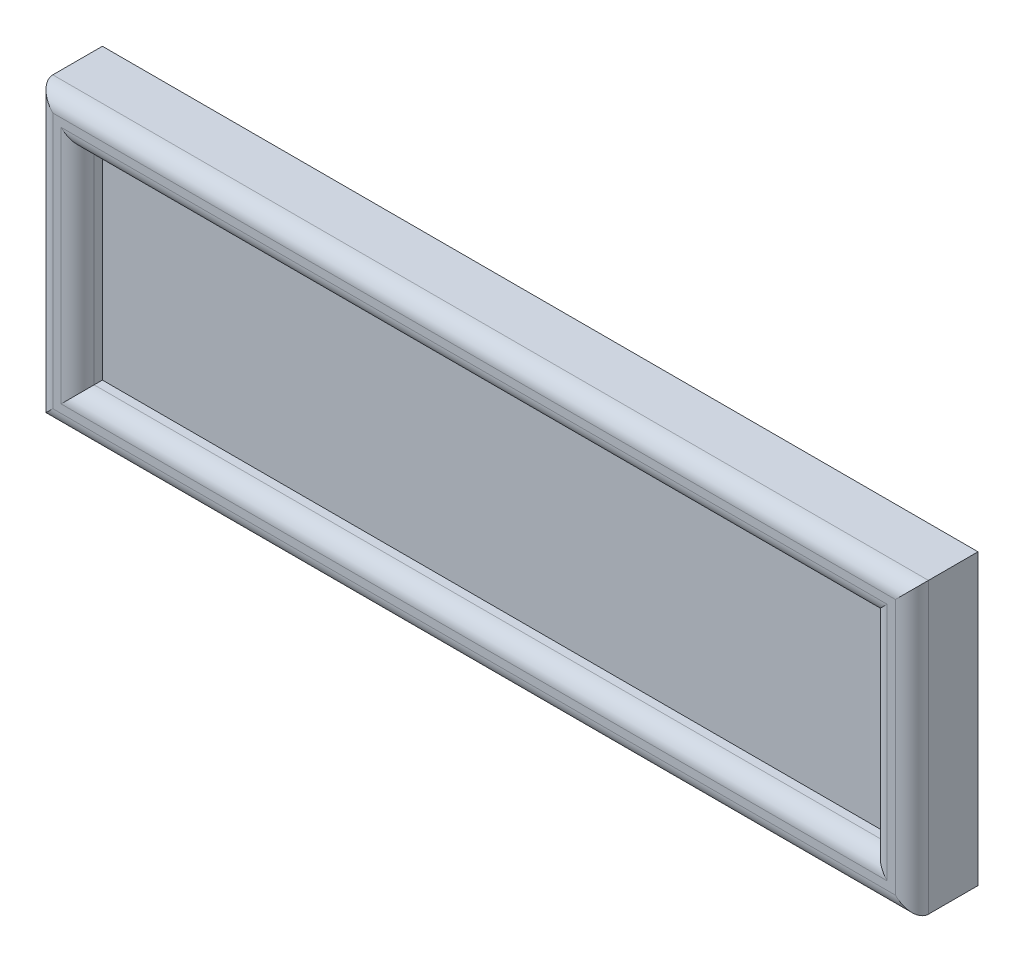
from build123d import *

# Parameters (mm, degrees)
SKETCH_1_W          = 53
SKETCH_1_H          = 17.5
EXTRUDE_1_DEPTH     = 2
SKETCH_3_W          = 51
SKETCH_3_H          = 15.5
CUT_EXTRUDE_2_DEPTH = 0.5
SKETCH_2_W          = 48
SKETCH_2_H          = 12.5
CUT_EXTRUDE_3_DEPTH = 2
FILLET_1_R          = 1
SKETCH_5_W          = 0.1
SKETCH_5_H          = 15.5
CUT_EXTRUDE_5_DEPTH = 28.978786607


with BuildPart() as part:
    # Эскиз1 → Бобышка-Вытянуть1 (new, symmetric)
    with BuildSketch(Plane.XY):
        Rectangle(SKETCH_1_W, SKETCH_1_H)
    extrude(amount=EXTRUDE_1_DEPTH, both=True)

    # Эскиз3 → Вырез-Вытянуть2 (cut, symmetric)
    with BuildSketch(Plane.XY):
        Rectangle(SKETCH_3_W, SKETCH_3_H)
    extrude(amount=CUT_EXTRUDE_2_DEPTH, both=True, mode=Mode.SUBTRACT)

    # Эскиз2 → Вырез-Вытянуть3 (cut)
    with BuildSketch(Plane.XY.offset(2)):
        Rectangle(SKETCH_2_W, SKETCH_2_H)
    extrude(amount=-CUT_EXTRUDE_3_DEPTH, mode=Mode.SUBTRACT)

    # Скругление1
    fillet_1_edges = [part.edges().sort_by_distance(p)[0] for p in [
        (26.5, 0, 2),
        (0, 8.75, 2),
        (-24, 0, 2),
        (0, -6.25, 2),
        (24, 0, 2),
        (0, 6.25, 2),
        (-26.5, 0, 2),
        (0, -8.75, 2),
    ]]
    fillet(fillet_1_edges, radius=FILLET_1_R)

    # Эскиз5 → Вырез-Вытянуть5 (cut, through all)
    with BuildSketch(Plane(origin=(0, 0, 0), x_dir=(0, 0, -1), z_dir=(1, 0, 0))):
        with Locations((-0.05, 0)):
            Rectangle(SKETCH_5_W, SKETCH_5_H)
    extrude(amount=-CUT_EXTRUDE_5_DEPTH, mode=Mode.SUBTRACT)


solid = part.part
